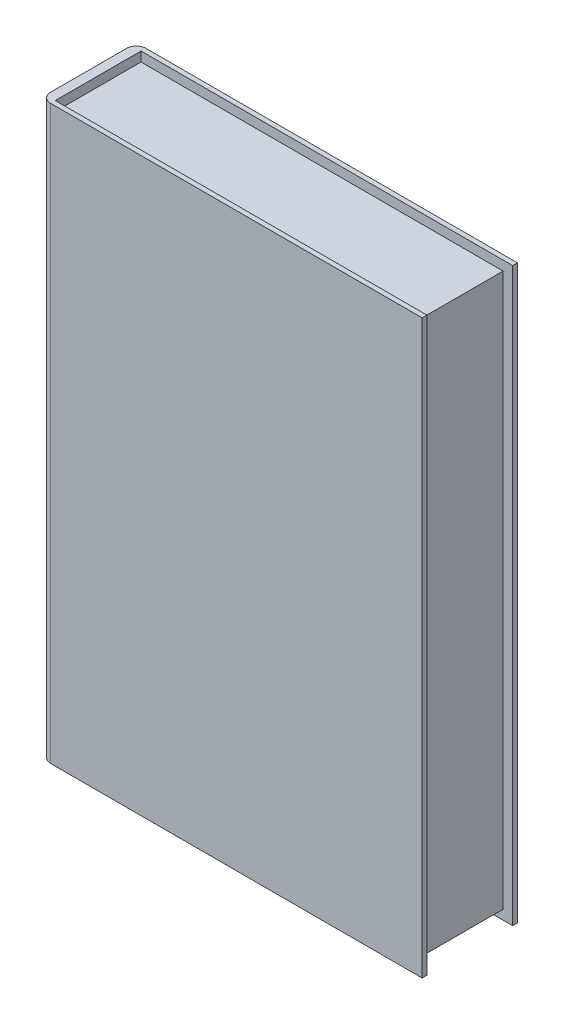
from build123d import *

# Parameters (mm, degrees)
SKETCH7_W           = 80
SKETCH7_H           = 120
BOSS_EXTRUDE2_DEPTH = 10
SKETCH8_W           = 78
SKETCH8_H           = 18
CUT_EXTRUDE1_DEPTH  = 2
SKETCH9_W           = 18
SKETCH9_H           = 117
CUT_EXTRUDE2_DEPTH  = 2
SKETCH10_W          = 78
SKETCH10_H          = 18
CUT_EXTRUDE3_DEPTH  = 2
FILLET1_R           = 2


with BuildPart() as part:
    # Sketch7 → Boss-Extrude2 (new, symmetric)
    with BuildSketch(Plane.XY):
        with Locations((38.421052632, -28.157894737)):
            Rectangle(SKETCH7_W, SKETCH7_H)
    extrude(amount=BOSS_EXTRUDE2_DEPTH, both=True)

    # Sketch8 → Cut-Extrude1 (cut)
    with BuildSketch(Plane(origin=(0, 31.842105263, 0), x_dir=(1, 0, 0), z_dir=(0, 1, 0))):
        with Locations((39.421052632, 0)):
            Rectangle(SKETCH8_W, SKETCH8_H)
    extrude(amount=-CUT_EXTRUDE1_DEPTH, mode=Mode.SUBTRACT)

    # Sketch9 → Cut-Extrude2 (cut)
    with BuildSketch(Plane(origin=(78.421052632, 0, 0), x_dir=(0, 0, -1), z_dir=(1, 0, 0))):
        with Locations((0, -28.657894737)):
            Rectangle(SKETCH9_W, SKETCH9_H)
    extrude(amount=-CUT_EXTRUDE2_DEPTH, mode=Mode.SUBTRACT)

    # Sketch10 → Cut-Extrude3 (cut)
    with BuildSketch(Plane.XZ.offset(88.157894737)):
        with Locations((39.421052632, 0)):
            Rectangle(SKETCH10_W, SKETCH10_H)
    extrude(amount=-CUT_EXTRUDE3_DEPTH, mode=Mode.SUBTRACT)

    # Fillet1
    fillet1_edges = [part.edges().sort_by_distance(p)[0] for p in [
        (-1.578947368, -28.157894737, 10),
        (-1.578947368, -28.157894737, -10),
    ]]
    fillet(fillet1_edges, radius=FILLET1_R)


solid = part.part
